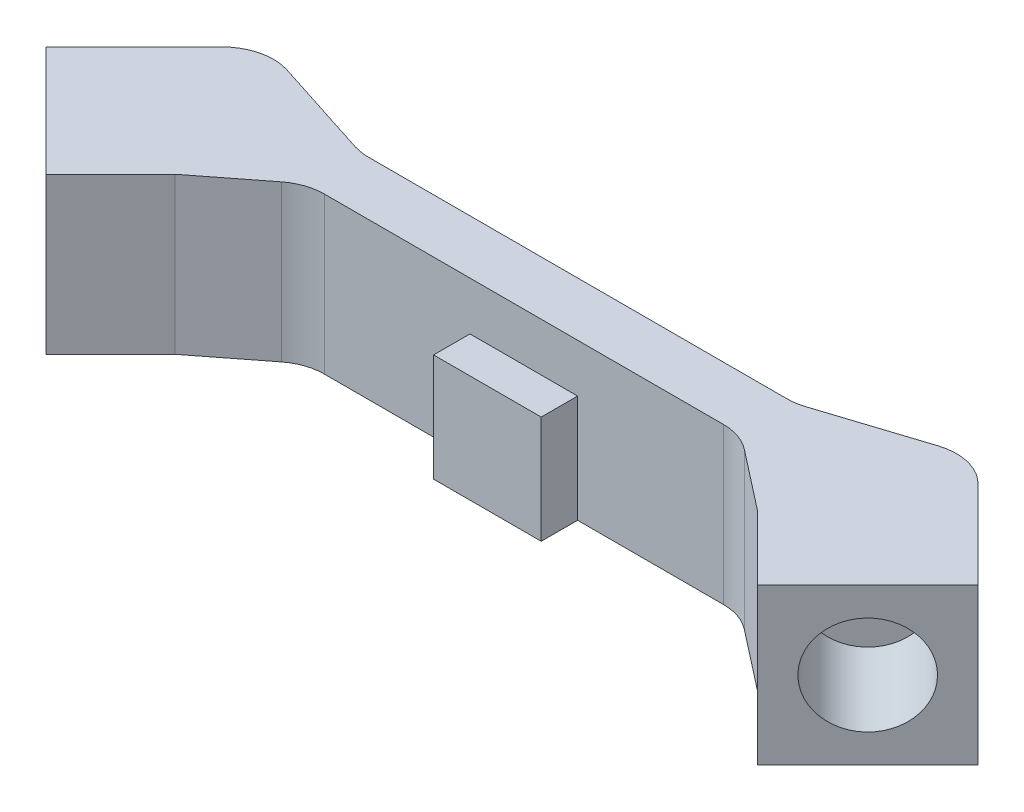
from build123d import *

# Parameters (mm, degrees)
BOSS_EXTRUDE1_DEPTH = 38.1
SKETCH2_R           = 12.065
CUT_EXTRUDE1_DEPTH  = 25.4
SKETCH7_R           = 12.065
CUT_EXTRUDE2_DEPTH  = 25.4
SKETCH8_W           = 26.289
SKETCH8_H           = 26.289
BOSS_EXTRUDE2_DEPTH = 8.89


with BuildPart() as part:
    # Sketch1 → Boss-Extrude1 (new body)
    with BuildSketch(Plane(origin=(0, 0, 0), x_dir=(1, 0, 0), z_dir=(0, 1, 0))):
        with BuildLine():
            Line((-8.394951703, 35.720764917), (16.107614613, 27.828435078))
            ThreePointArc((16.107614613, 27.828435078), (18.03059142, 27.370657964), (20.001310729, 27.216823331))
            Line((20.001310729, 27.216823331), (122.238689271, 27.216823331))
            ThreePointArc((122.238689271, 27.216823331), (124.20940858, 27.370657964), (126.132385387, 27.828435078))
            Line((126.132385387, 27.828435078), (150.634951703, 35.720764917))
            ThreePointArc((150.634951703, 35.720764917), (157.509150211, 35.977683688), (163.508903941, 32.612632786))
            Line((163.508903941, 32.612632786), (184.96230509, 11.159231637))
            Line((184.96230509, 11.159231637), (158.021536726, -15.781536726))
            Line((158.021536726, -15.781536726), (142.24, 0))
            Line((142.24, 0), (127.676821583, 11.356327171))
            ThreePointArc((127.676821583, 11.356327171), (123.996342172, 13.351360126), (119.867179962, 14.041363479))
            Line((119.867179962, 14.041363479), (22.372820038, 14.041363479))
            ThreePointArc((22.372820038, 14.041363479), (18.243657828, 13.351360126), (14.563178417, 11.356327171))
            Line((14.563178417, 11.356327171), (0, 0))
            Line((0, 0), (-15.781536726, -15.781536726))
            Line((-15.781536726, -15.781536726), (-42.72230509, 11.159231637))
            Line((-42.72230509, 11.159231637), (-21.268903941, 32.612632786))
            ThreePointArc((-21.268903941, 32.612632786), (-15.269150211, 35.977683688), (-8.394951703, 35.720764917))
        make_face()
    extrude(amount=BOSS_EXTRUDE1_DEPTH)

    # Sketch2 → Cut-Extrude1 (cut)
    with BuildSketch(Plane(origin=(-15.781536726, 0, 15.781536726), x_dir=(0.7071067811865477, 0, 0.7071067811865475), z_dir=(-0.7071067811865475, 0, 0.7071067811865477))):
        with Locations((-19.05, 19.05)):
            Circle(SKETCH2_R)
    extrude(amount=-CUT_EXTRUDE1_DEPTH, mode=Mode.SUBTRACT)

    # Sketch7 → Cut-Extrude2 (cut)
    with BuildSketch(Plane(origin=(86.901536726, 0, 86.901536726), x_dir=(0.7071067811865472, 0, -0.7071067811865478), z_dir=(0.7071067811865478, 0, 0.7071067811865472))):
        with Locations((119.628868556, 19.05)):
            Circle(SKETCH7_R)
    extrude(amount=-CUT_EXTRUDE2_DEPTH, mode=Mode.SUBTRACT)

    # Sketch8 → Boss-Extrude2 (add)
    with BuildSketch(Plane.XY.offset(-14.041363479)):
        with Locations((71.12, 13.1445)):
            Rectangle(SKETCH8_W, SKETCH8_H)
    extrude(amount=BOSS_EXTRUDE2_DEPTH)


solid = part.part
